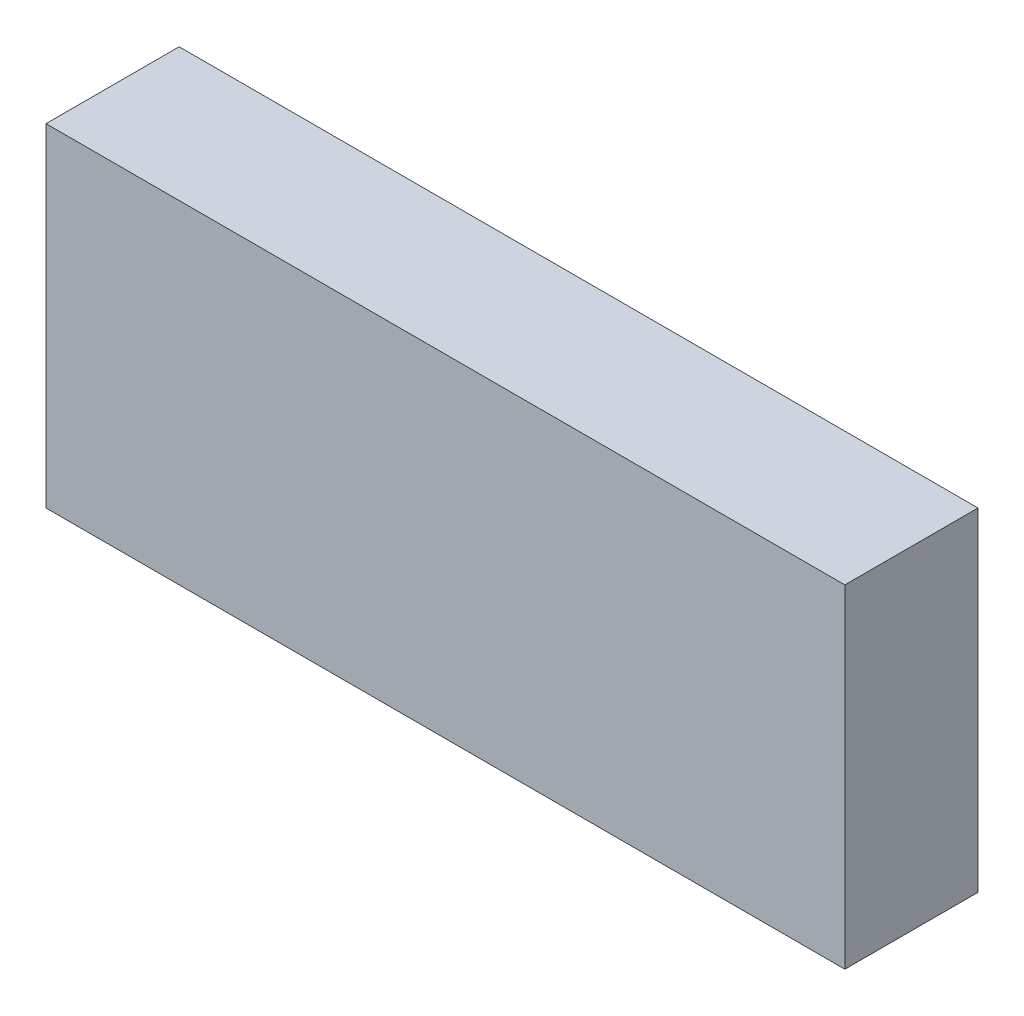
from build123d import *

# Parameters (mm, degrees)
SKETCH1_W           = 120
SKETCH1_H           = 50
BOSS_EXTRUDE1_DEPTH = 20


with BuildPart() as part:
    # Sketch1 → Boss-Extrude1 (new body)
    with BuildSketch(Plane.XY):
        Rectangle(SKETCH1_W, SKETCH1_H)
    extrude(amount=BOSS_EXTRUDE1_DEPTH)


solid = part.part
